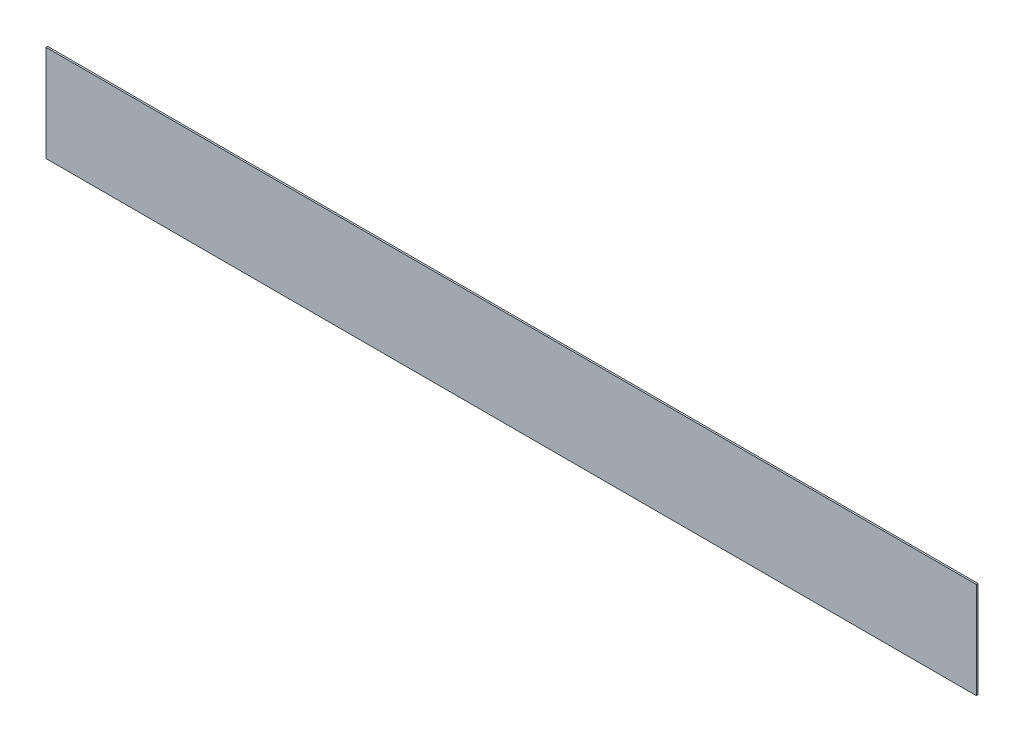
from build123d import *

# Parameters (mm, degrees)
SKETCH1_W           = 700
SKETCH1_H           = 72.46
BOSS_EXTRUDE1_DEPTH = 1.27


with BuildPart() as part:
    # Sketch1 → Boss-Extrude1 (new body)
    with BuildSketch(Plane.XY):
        with Locations((350, 36.23)):
            Rectangle(SKETCH1_W, SKETCH1_H)
    extrude(amount=BOSS_EXTRUDE1_DEPTH)


solid = part.part
